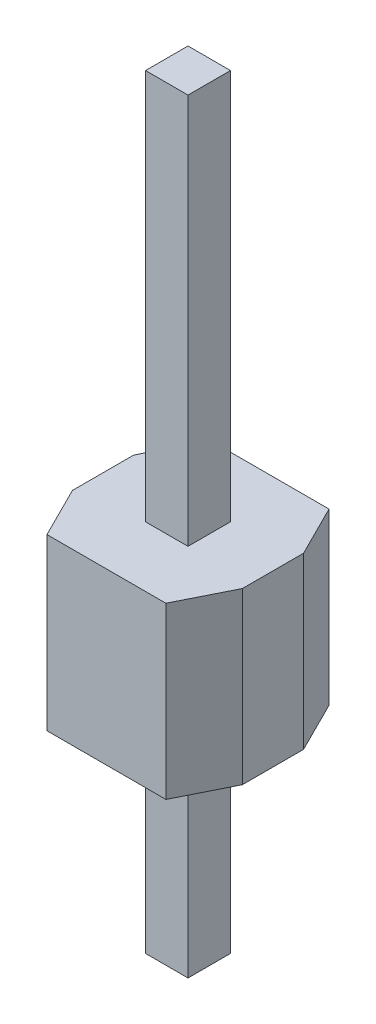
from build123d import *

# Parameters (mm, degrees)
BOSS_EXTRUDE1_DEPTH = 2.54
SKETCH2_W           = 0.635
SKETCH2_H           = 0.635
BOSS_EXTRUDE2_DEPTH = 5.842
SKETCH5_W           = 0.635
SKETCH5_H           = 0.635
BOSS_EXTRUDE3_DEPTH = 3.048


with BuildPart() as part:
    # Sketch1 → Boss-Extrude1 (new body)
    with BuildSketch(Plane(origin=(0, 0, 0), x_dir=(1, 0, 0), z_dir=(0, 1, 0))):
        Polygon((0.381, 0), (0, 0.762), (0, 1.6764), (0.381, 2.4384), (2.159, 2.4384), (2.54, 1.6764), (2.54, 0.762), (2.159, 0), align=None)
    extrude(amount=BOSS_EXTRUDE1_DEPTH)

    # Sketch2 → Boss-Extrude2 (add)
    with BuildSketch(Plane(origin=(0, 2.54, 0), x_dir=(1, 0, 0), z_dir=(0, 1, 0))):
        with Locations((1.27, 1.2192)):
            Rectangle(SKETCH2_W, SKETCH2_H)
    extrude(amount=BOSS_EXTRUDE2_DEPTH)

    # Sketch5 → Boss-Extrude3 (add)
    with BuildSketch(Plane.XZ):
        with Locations((1.27, -1.2192)):
            Rectangle(SKETCH5_W, SKETCH5_H)
    extrude(amount=BOSS_EXTRUDE3_DEPTH)


solid = part.part
